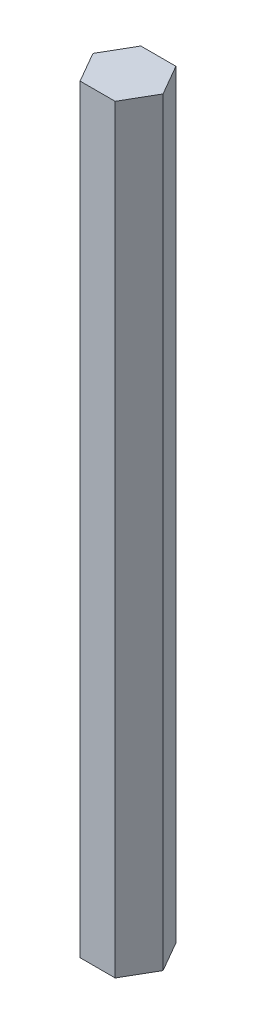
from build123d import *

# Parameters (mm, degrees)
BOSS_EXTRUDE1_DEPTH = 100


with BuildPart() as part:
    # Sketch1 → Boss-Extrude1 (new body)
    with BuildSketch(Plane(origin=(0, 0, 0), x_dir=(1, 0, 0), z_dir=(0, 1, 0))):
        Polygon((4.618802154, 0), (2.309401077, 4), (-2.309401077, 4), (-4.618802154, 0), (-2.309401077, -4), (2.309401077, -4), align=None)
    extrude(amount=BOSS_EXTRUDE1_DEPTH)


solid = part.part
